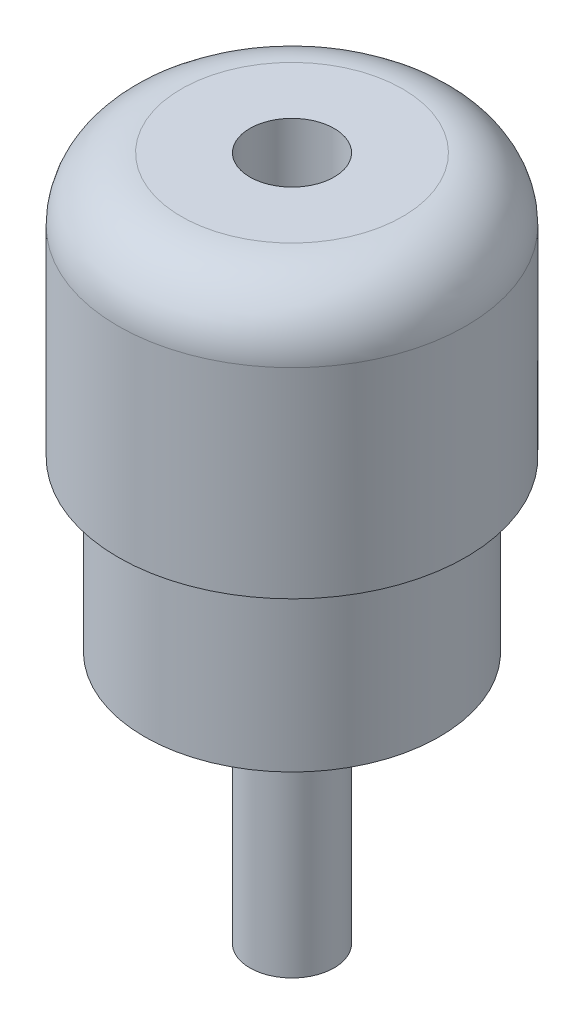
from build123d import *

# Parameters (mm, degrees)
CROQUIS2_R            = 2
CORTAR_EXTRUIR1_DEPTH = 10
REDONDEO1_R           = 3


with BuildPart() as part:
    # Croquis1 → Revolución1 (revolve)
    with BuildSketch(Plane.XY, mode=Mode.PRIVATE) as revoluci_n1_sk:
        Polygon((0, 0), (2, 0), (2, 12), (7, 12), (7, 20), (8.25, 20), (8.25, 32.5), (0, 32.5), align=None)
    revolve(revoluci_n1_sk.sketch.rotate(Axis((0, 32.5, 0), (0, -1, 0)), 90), axis=Axis((0, 32.5, 0), (0, -1, 0)))

    # Croquis2 → Cortar-Extruir1 (cut)
    with BuildSketch(Plane(origin=(0, 32.5, 0), x_dir=(1, 0, 0), z_dir=(0, 1, 0))):
        with Locations(Location((0, 0, 0), (0, 0, 270))):
            Circle(CROQUIS2_R)
    extrude(amount=-CORTAR_EXTRUIR1_DEPTH, mode=Mode.SUBTRACT)

    # Redondeo1
    redondeo1_edges = [part.edges().sort_by_distance(p)[0] for p in [
        (0, 32.5, -8.25),
    ]]
    fillet(redondeo1_edges, radius=REDONDEO1_R)


solid = part.part
